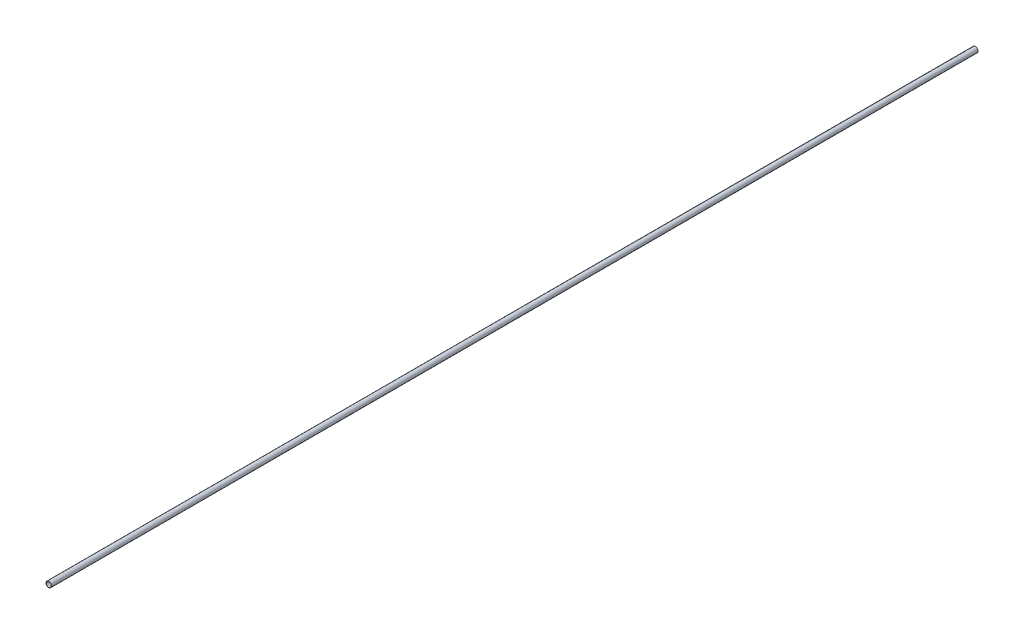
from build123d import *

# Parameters (mm, degrees)
SKETCH1_R           = 8.9662
SKETCH1_R_2         = 7.8994
BOSS_EXTRUDE1_DEPTH = 3048


with BuildPart() as part:
    # Sketch1 → Boss-Extrude1 (new body)
    with BuildSketch(Plane.XY):
        Circle(SKETCH1_R)
        Circle(SKETCH1_R_2, mode=Mode.SUBTRACT)
    extrude(amount=BOSS_EXTRUDE1_DEPTH)


solid = part.part
